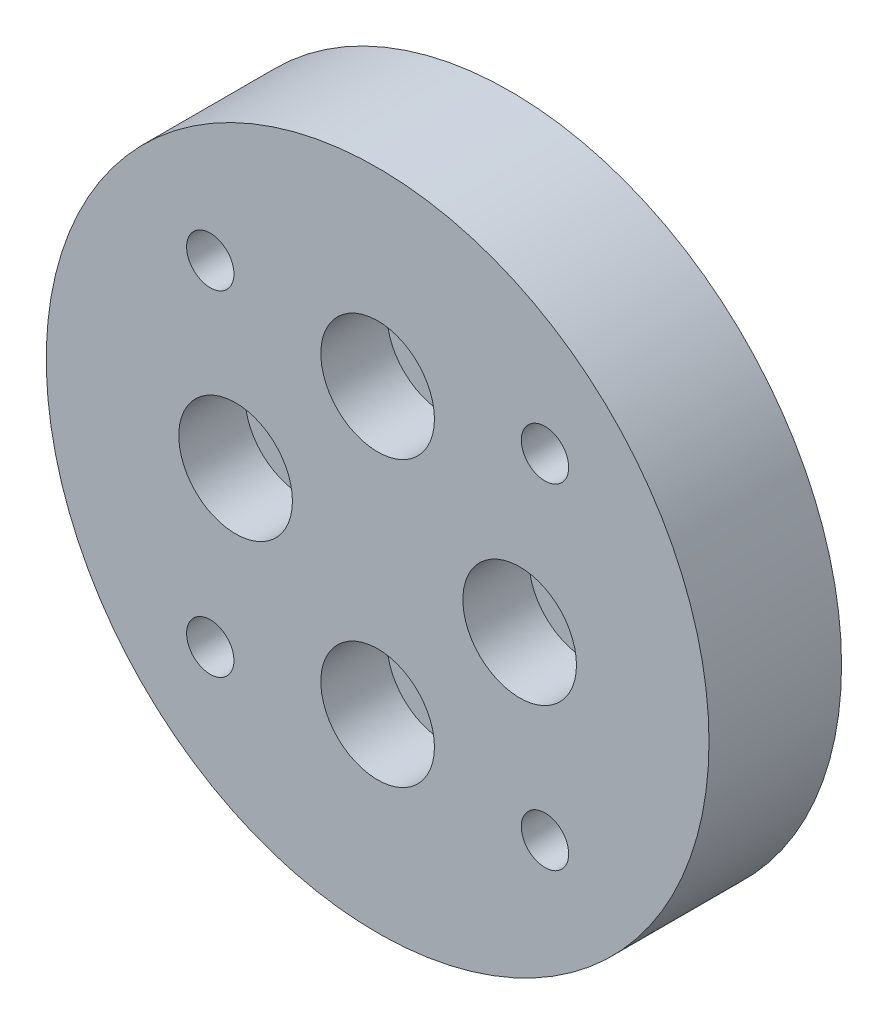
from build123d import *

# Parameters (mm, degrees)
SKETCH_1_R          = 17.5
SKETCH_1_R_2        = 1.25
EXTRUDE_1_DEPTH     = 7
SKETCH_2_R          = 3
CUT_EXTRUDE_1_DEPTH = 3.5


with BuildPart() as part:
    # 草图1 → 凸台-拉伸1 (new body)
    with BuildSketch(Plane.XY):
        Circle(SKETCH_1_R)
        with Locations((0, 7.5)):
            Circle(SKETCH_1_R_2, mode=Mode.SUBTRACT)
        with Locations((7.5, 0)):
            Circle(SKETCH_1_R_2, mode=Mode.SUBTRACT)
        with Locations((0, -7.5)):
            Circle(SKETCH_1_R_2, mode=Mode.SUBTRACT)
        with Locations((-7.5, 0)):
            Circle(SKETCH_1_R_2, mode=Mode.SUBTRACT)
        with Locations((8.838834765, 8.838834765)):
            Circle(SKETCH_1_R_2, mode=Mode.SUBTRACT)
        with Locations((8.838834765, -8.838834765)):
            Circle(SKETCH_1_R_2, mode=Mode.SUBTRACT)
        with Locations((-8.838834765, -8.838834765)):
            Circle(SKETCH_1_R_2, mode=Mode.SUBTRACT)
        with Locations((-8.838834765, 8.838834765)):
            Circle(SKETCH_1_R_2, mode=Mode.SUBTRACT)
    extrude(amount=EXTRUDE_1_DEPTH)

    # 草图2 → 切除-拉伸1 (cut)
    with BuildSketch(Plane.XY.offset(7)):
        with Locations((0, 7.5)):
            Circle(SKETCH_2_R)
        with Locations((7.5, 0)):
            Circle(SKETCH_2_R)
        with Locations((0, -7.5)):
            Circle(SKETCH_2_R)
        with Locations((-7.5, 0)):
            Circle(SKETCH_2_R)
    extrude(amount=-CUT_EXTRUDE_1_DEPTH, mode=Mode.SUBTRACT)


solid = part.part
